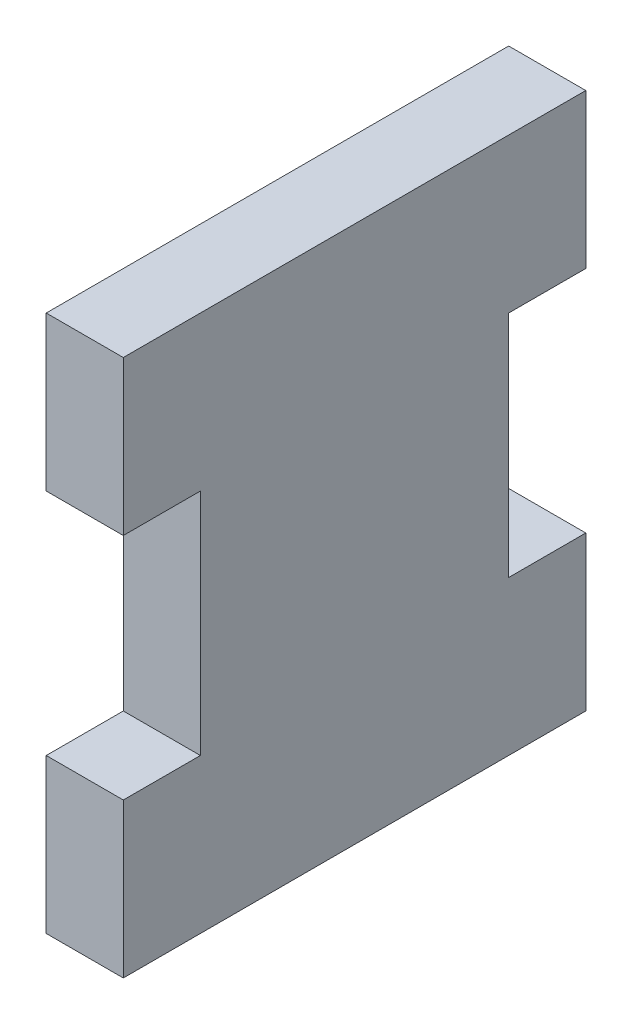
from build123d import *

# Parameters (mm, degrees)
SKETCH1_W           = 3.175
SKETCH1_H           = 22.134285714
BOSS_EXTRUDE1_DEPTH = 19.05
SKETCH2_W           = 3.175
SKETCH2_H           = 9.434285714
CUT_EXTRUDE1_DEPTH  = 5.08


with BuildPart() as part:
    # Sketch1 → Boss-Extrude1 (new body)
    with BuildSketch(Plane.XY):
        with Locations((133.538466969, 85.485595066)):
            Rectangle(SKETCH1_W, SKETCH1_H)
    extrude(amount=-BOSS_EXTRUDE1_DEPTH)

    # Sketch2 → Cut-Extrude1 (cut)
    with BuildSketch(Plane(origin=(135.125966969, 0, 0), x_dir=(0, 0, -1), z_dir=(1, 0, 0))):
        with Locations((1.5875, 85.485595066)):
            Rectangle(SKETCH2_W, SKETCH2_H)
        with Locations((17.4625, 85.485595066)):
            Rectangle(SKETCH2_W, SKETCH2_H)
    extrude(amount=-CUT_EXTRUDE1_DEPTH, mode=Mode.SUBTRACT)


solid = part.part
